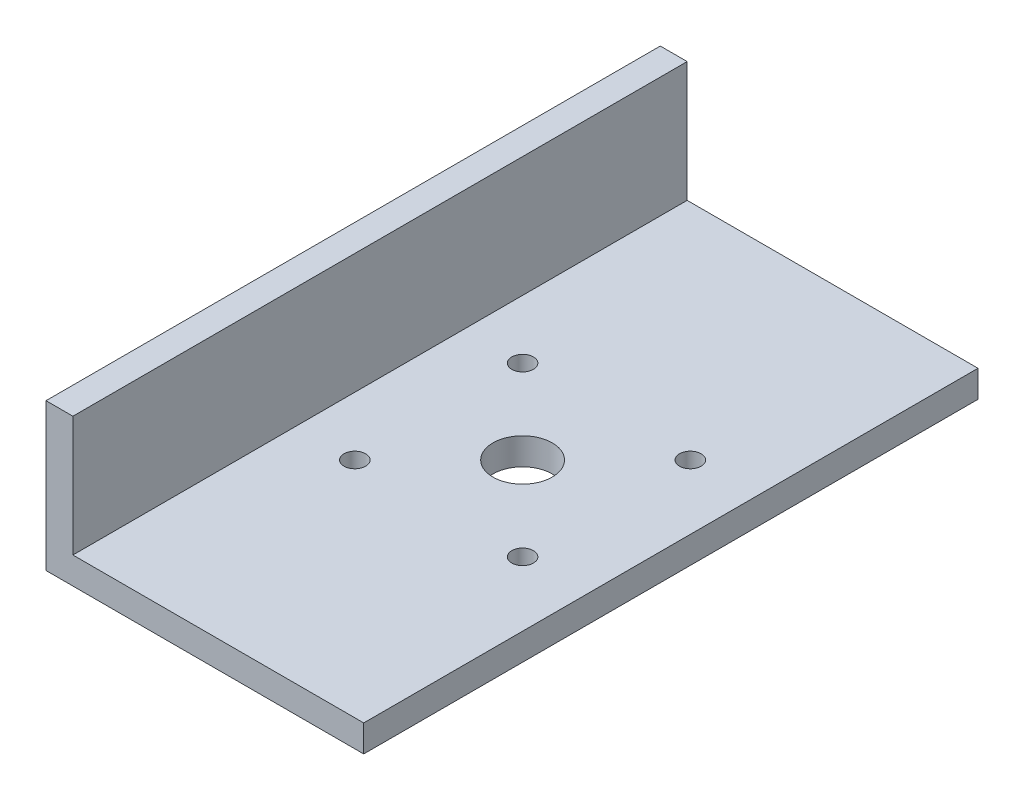
from build123d import *

# Parameters (mm, degrees)
BOSS_EXTRUDE1_DEPTH = 145
SKETCH2_W           = 68.65
SKETCH2_H           = 145
CUT_EXTRUDE1_DEPTH  = 10
SKETCH3_R           = 7
CUT_EXTRUDE2_DEPTH  = 10
SKETCH4_R           = 2.55
CUT_EXTRUDE3_DEPTH  = 10
SKETCH5_W           = 278.618693002
SKETCH5_H           = 61.467749786
CUT_EXTRUDE4_DEPTH  = 10


with BuildPart() as part:
    # Sketch1 → Boss-Extrude1 (new body)
    with BuildSketch(Plane.XY):
        Polygon((0, -37.5), (0, 37.5), (75, 37.5), (75, 31.15), (6.35, 31.15), (6.35, -31.15), (75, -31.15), (75, -37.5), align=None)
    extrude(amount=BOSS_EXTRUDE1_DEPTH)

    # Sketch2 → Cut-Extrude1 (cut)
    with BuildSketch(Plane(origin=(0, 37.5, 0), x_dir=(1, 0, 0), z_dir=(0, 1, 0))):
        with Locations((40.675, -72.5)):
            Rectangle(SKETCH2_W, SKETCH2_H)
    extrude(amount=-CUT_EXTRUDE1_DEPTH, mode=Mode.SUBTRACT)

    # Sketch3 → Cut-Extrude2 (cut)
    with BuildSketch(Plane.XZ.offset(37.5)):
        with Locations(Location((40, 72.5, 0), (0, 0, 270))):
            Circle(SKETCH3_R)
    extrude(amount=-CUT_EXTRUDE2_DEPTH, mode=Mode.SUBTRACT)

    # Sketch4 → Cut-Extrude3 (cut)
    with BuildSketch(Plane(origin=(0, -31.15, 0), x_dir=(1, 0, 0), z_dir=(0, 1, 0))):
        with Locations(Location((59.798989873, -52.701010127, 0), (0, 0, 270))):
            Circle(SKETCH4_R)
        with Locations(Location((59.798989873, -92.298989873, 0), (0, 0, 270))):
            Circle(SKETCH4_R)
        with Locations(Location((20.201010127, -92.298989873, 0), (0, 0, 270))):
            Circle(SKETCH4_R)
        with Locations(Location((20.201010127, -52.701010127, 0), (0, 0, 270))):
            Circle(SKETCH4_R)
    extrude(amount=-CUT_EXTRUDE3_DEPTH, mode=Mode.SUBTRACT)

    # Sketch5 → Cut-Extrude4 (cut)
    with BuildSketch(Plane(origin=(6.35, 0, 0), x_dir=(0, 0, -1), z_dir=(1, 0, 0))):
        with Locations((-29.250225685, 27.958406515)):
            Rectangle(SKETCH5_W, SKETCH5_H)
    extrude(amount=-CUT_EXTRUDE4_DEPTH, mode=Mode.SUBTRACT)


solid = part.part
